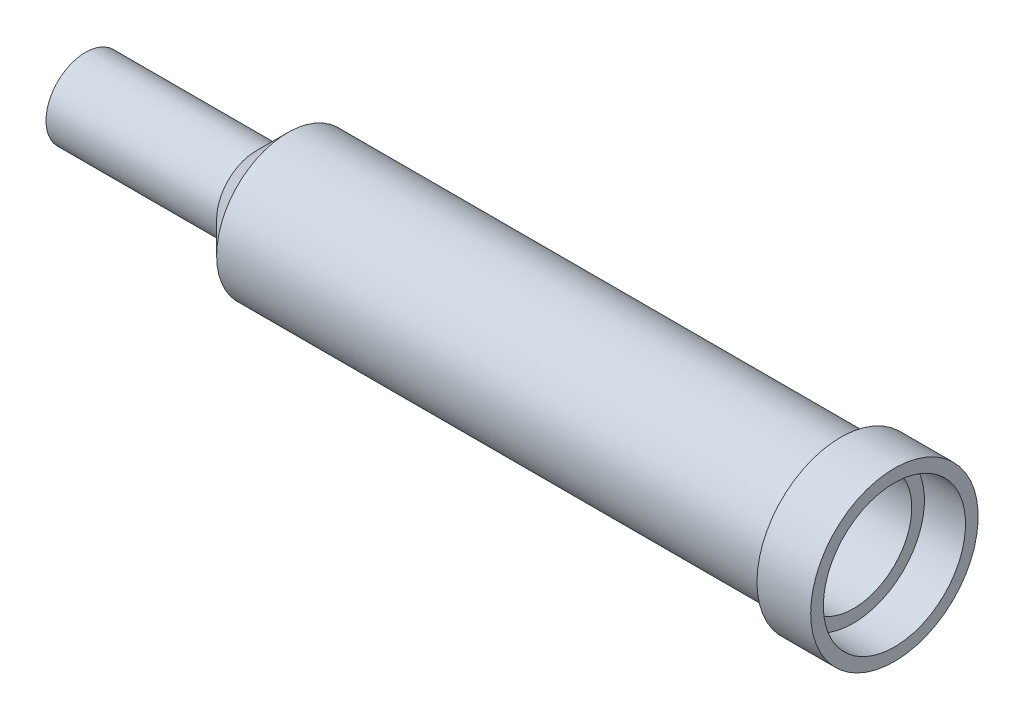
from build123d import *


with BuildPart() as part:
    # Sketch1 → Revolve1 (revolve)
    with BuildSketch(Plane(origin=(0, 0, 0), x_dir=(1, 0, 0), z_dir=(0, 1, 0)), mode=Mode.PRIVATE) as revolve1_sk:
        Polygon((-25.6, 0.85), (-20.034314575, 0.85), (-19.034314575, 1.85), (-1.3, 1.85), (-1.3, 2.25), (0, 2.25), (0, 2.65), (-1.7, 2.65), (-1.7, 2.25), (-19.2, 2.25), (-20.2, 1.25), (-25.6, 1.25), align=None)
    revolve(revolve1_sk.sketch.rotate(Axis((-52.117092297, 0, 0), (1, 0, 0)), 180), axis=Axis((-52.117092297, 0, 0), (1, 0, 0)))


solid = part.part
